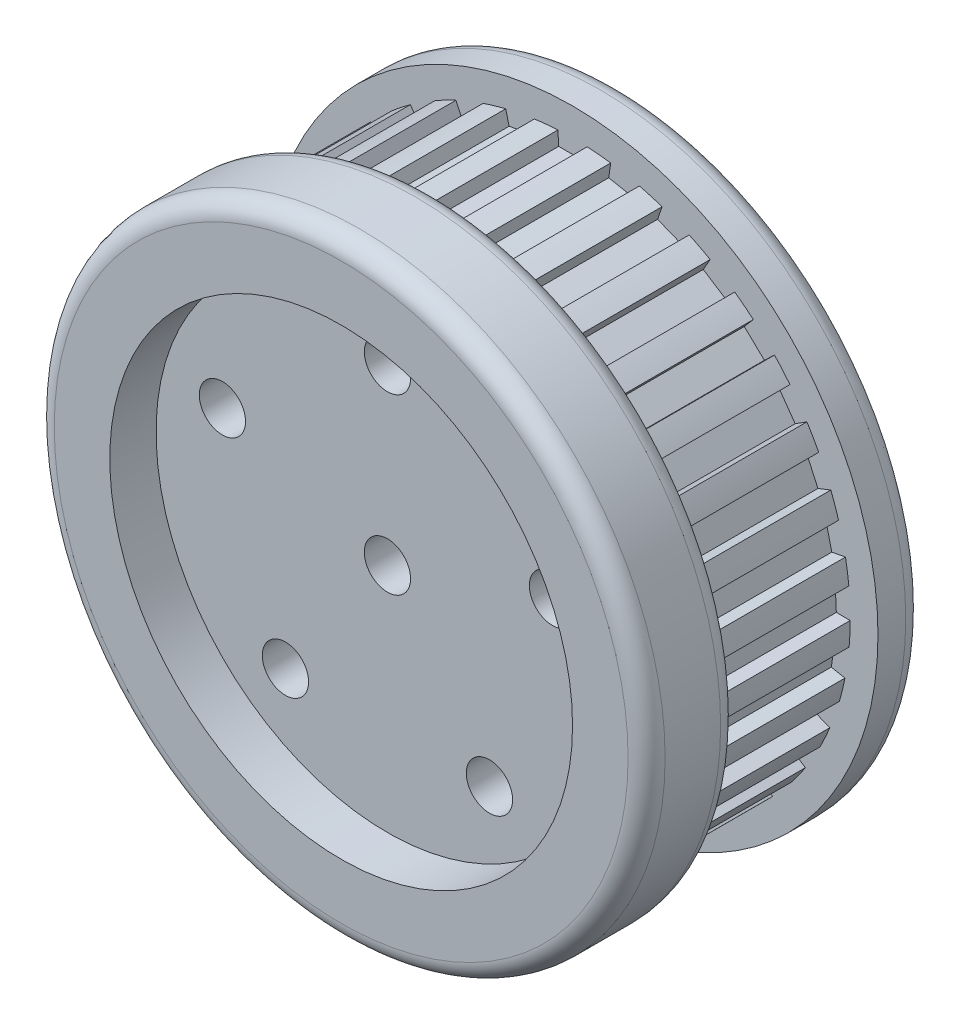
from build123d import *

# Parameters (mm, degrees)
SKETCH3_R          = 2.5
CUT_EXTRUDE1_DEPTH = 50.020403915
CUT_EXTRUDE2_DEPTH = 15
CIRPATTERN1_COUNT  = 33
FILLET1_R          = 2


with BuildPart() as part:
    # Sketch1 → Revolve1 (revolve)
    with BuildSketch(Plane(origin=(0, 0, 0), x_dir=(1, 0, 0), z_dir=(0, 1, 0))):
        Polygon((0, 0), (0, 10), (25, 10), (25, 25), (33, 25), (33, 20), (30, 20), (30, 5), (33, 5), (33, -5), (25, -5), (25, 0), align=None)
    revolve(axis=Axis((0, 0, 0), (0, 0, -1)))

    # Sketch3 → Cut-Extrude1 (cut, through all)
    with BuildSketch(Plane(origin=(0, 0, -10), x_dir=(-1, 0, 0), z_dir=(0, 0, -1))):
        Circle(SKETCH3_R)
        with Locations((0, 18.75)):
            Circle(SKETCH3_R)
        with Locations((17.832309681, 5.794068645)):
            Circle(SKETCH3_R)
        with Locations((11.02097348, -15.169068645)):
            Circle(SKETCH3_R)
        with Locations((-11.02097348, -15.169068645)):
            Circle(SKETCH3_R)
        with Locations((-17.832309681, 5.794068645)):
            Circle(SKETCH3_R)
    extrude(amount=-CUT_EXTRUDE1_DEPTH, mode=Mode.SUBTRACT)

    # Sketch5 → Cut-Extrude2 (cut)
    with BuildSketch(Plane(origin=(0, 0, -5), x_dir=(-1, 0, 0), z_dir=(0, 0, -1))):
        with BuildLine():
            Line((-1.5, 28.460498942), (1.5, 28.460498942))
            Line((1.5, 28.460498942), (1.578947368, 29.958419938))
            ThreePointArc((1.578947368, 29.958419938), (0, 30), (-1.578947368, 29.958419938))
            Line((-1.578947368, 29.958419938), (-1.5, 28.460498942))
        make_face()
    cut_extrude2 = extrude(amount=CUT_EXTRUDE2_DEPTH, mode=Mode.SUBTRACT)

    # CirPattern1: Cut-Extrude2 ×33 about axis
    cirpattern1_axis = Axis((0, 0, 0), (0, 0, 1))
    for i in range(1, CIRPATTERN1_COUNT):
        add(cut_extrude2.rotate(cirpattern1_axis, i * 360 / CIRPATTERN1_COUNT), mode=Mode.SUBTRACT)

    # Fillet1
    fillet1_edges = [part.edges().sort_by_distance(p)[0] for p in [
        (-33, 0, 5),
        (-33, 0, -5),
        (-33, 0, -25),
        (-25, 0, -25),
        (-25, 0, -10),
    ]]
    fillet(fillet1_edges, radius=FILLET1_R)


solid = part.part
